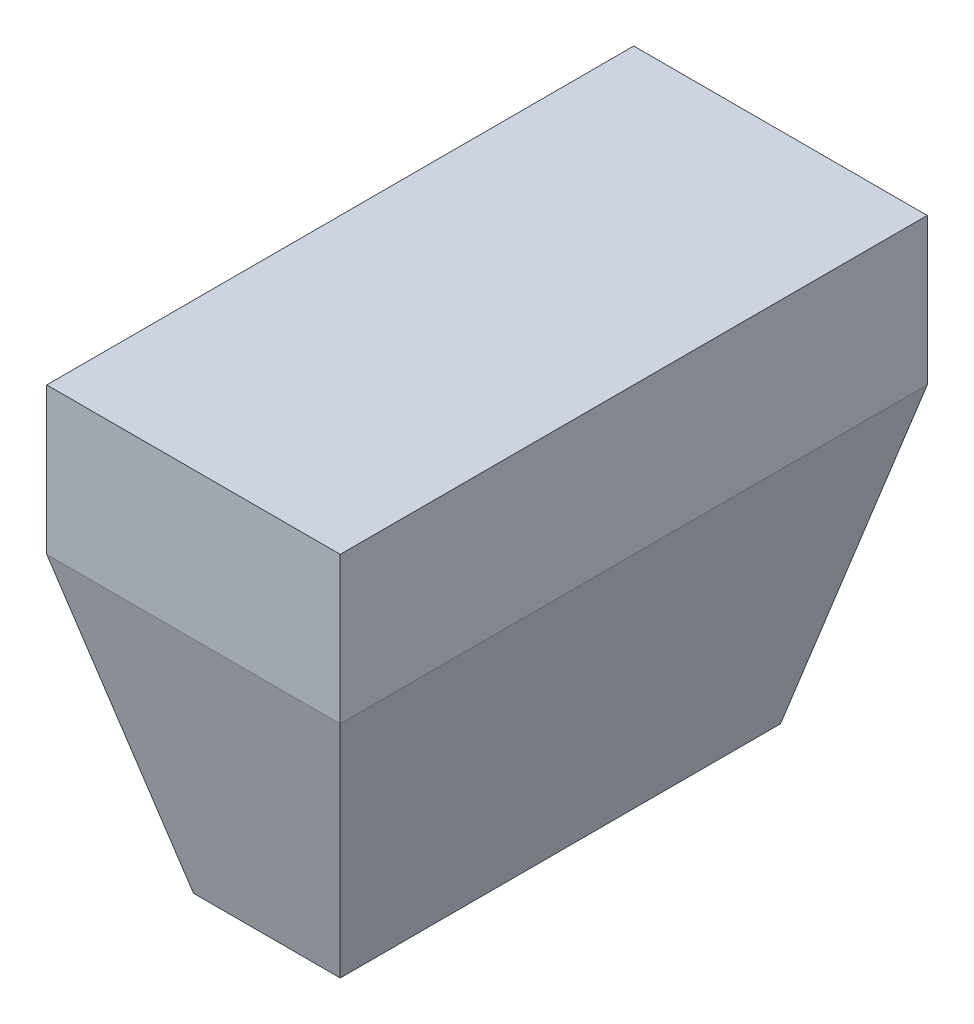
from build123d import *

# Parameters (mm, degrees)
SKETCH1_W           = 50.8
SKETCH1_H           = 101.6
BOSS_EXTRUDE1_DEPTH = 76.2
CHAMFER1_SIZE       = 12.7
CHAMFER1_SIZE2      = 50.8
CHAMFER2_SIZE       = 12.7
CHAMFER2_SIZE2      = 50.8
CHAMFER3_SIZE       = 12.7
CHAMFER3_SIZE2      = 50.8
CHAMFER4_SIZE       = 12.7
CHAMFER4_SIZE2      = 50.8


with BuildPart() as part:
    # Sketch1 → Boss-Extrude1 (new body)
    with BuildSketch(Plane(origin=(0, 0, 0), x_dir=(1, 0, 0), z_dir=(0, 1, 0))):
        Rectangle(SKETCH1_W, SKETCH1_H)
    extrude(amount=BOSS_EXTRUDE1_DEPTH)

    # Chamfer1
    chamfer1_edges = [part.edges().sort_by_distance(p)[0] for p in [
        (25.4, 0, 0),
    ]]
    chamfer1_side = [part.faces().sort_by_distance(p)[0] for p in [
        (0, 0, 0),
    ]]
    chamfer(chamfer1_edges, length=CHAMFER1_SIZE, length2=CHAMFER1_SIZE2, reference=chamfer1_side[0])

    # Chamfer2
    chamfer2_edges = [part.edges().sort_by_distance(p)[0] for p in [
        (-25.4, 0, 0),
    ]]
    chamfer2_side = [part.faces().sort_by_distance(p)[0] for p in [
        (-6.35, 0, 0),
    ]]
    chamfer(chamfer2_edges, length=CHAMFER2_SIZE, length2=CHAMFER2_SIZE2, reference=chamfer2_side[0])

    # Chamfer3
    chamfer3_edges = [part.edges().sort_by_distance(p)[0] for p in [
        (0, 0, 50.8),
    ]]
    chamfer3_side = [part.faces().sort_by_distance(p)[0] for p in [
        (0, 0, 0),
    ]]
    chamfer(chamfer3_edges, length=CHAMFER3_SIZE, length2=CHAMFER3_SIZE2, reference=chamfer3_side[0])

    # Chamfer4
    chamfer4_edges = [part.edges().sort_by_distance(p)[0] for p in [
        (0, 0, -50.8),
    ]]
    chamfer4_side = [part.faces().sort_by_distance(p)[0] for p in [
        (0, 0, -6.35),
    ]]
    chamfer(chamfer4_edges, length=CHAMFER4_SIZE, length2=CHAMFER4_SIZE2, reference=chamfer4_side[0])


solid = part.part
